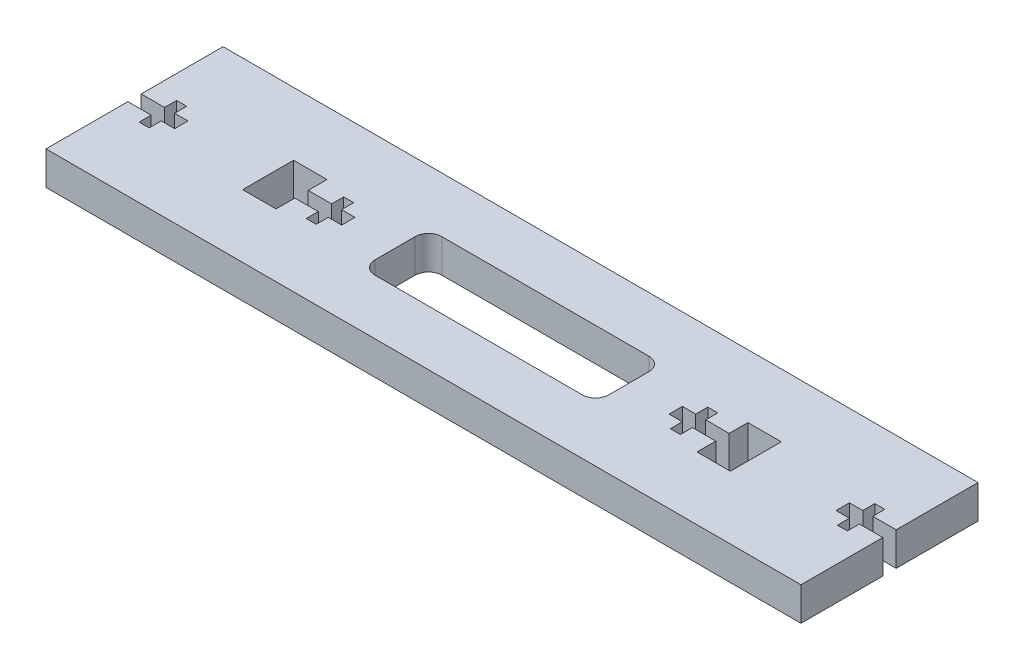
from build123d import *

# Parameters (mm, degrees)
ESBO_O1_W                = 113
ESBO_O1_H                = 26.5
RESSALTO_EXTRUS_O1_DEPTH = 5
ESBO_O2_W                = 5
ESBO_O2_H                = 7.62
CORTE_EXTRUS_O1_DEPTH    = 5
CORTE_EXTRUS_O2_DEPTH    = 5
CORTE_EXTRUS_O3_DEPTH    = 10


with BuildPart() as part:
    # Esboço1 → Ressalto-extrusão1 (new body)
    with BuildSketch(Plane(origin=(0, 0, 0), x_dir=(1, 0, 0), z_dir=(0, 1, 0))):
        with Locations((-20.23644711, -18.909257917)):
            Rectangle(ESBO_O1_W, ESBO_O1_H)
    extrude(amount=RESSALTO_EXTRUS_O1_DEPTH)

    # Esboço2 → Corte-extrusão1 (cut)
    with BuildSketch(Plane(origin=(0, 5, 0), x_dir=(1, 0, 0), z_dir=(0, 1, 0))):
        with Locations((13.76355289, -18.914257917)):
            Rectangle(ESBO_O2_W, ESBO_O2_H)
        with Locations((-54.23644711, -18.914257917)):
            Rectangle(ESBO_O2_W, ESBO_O2_H)
    extrude(amount=-CORTE_EXTRUS_O1_DEPTH, mode=Mode.SUBTRACT)

    # Esboço3 → Corte-extrusão2 (cut)
    with BuildSketch(Plane(origin=(0, 5, 0), x_dir=(1, 0, 0), z_dir=(0, 1, 0))):
        Polygon((-76.73644711, -17.909257917), (-73.23644711, -17.909257917), (-73.23644711, -16.109257917), (-71.73644711, -16.109257917), (-71.73644711, -17.909257917), (-69.73644711, -17.909257917), (-69.73644711, -19.909257917), (-71.73644711, -19.909257917), (-71.73644711, -21.709257917), (-73.23644711, -21.709257917), (-73.23644711, -19.909257917), (-76.73644711, -19.909257917), align=None)
        Polygon((-51.73644711, -17.909257917), (-48.23644711, -17.909257917), (-48.23644711, -16.109257917), (-46.73644711, -16.109257917), (-46.73644711, -17.909257917), (-44.73644711, -17.909257917), (-44.73644711, -19.909257917), (-46.73644711, -19.909257917), (-46.73644711, -21.709257917), (-48.23644711, -21.709257917), (-48.23644711, -19.909257917), (-51.73644711, -19.909257917), align=None)
    corte_extrus_o2 = extrude(amount=-CORTE_EXTRUS_O2_DEPTH, mode=Mode.SUBTRACT)

    # Espelhar1: Corte-extrusão2 across plane
    add(corte_extrus_o2.mirror(Plane.ZY.offset(20.23644711)), mode=Mode.SUBTRACT)

    # Esboço4 → Corte-extrusão3 (cut)
    with BuildSketch(Plane.XZ):
        with BuildLine():
            Line((-4.73644711, 13.909257917), (-35.73644711, 13.909257917))
            ThreePointArc((-35.73644711, 13.909257917), (-37.150660672, 14.495044355), (-37.73644711, 15.909257917))
            Line((-37.73644711, 15.909257917), (-37.73644711, 21.909257917))
            ThreePointArc((-37.73644711, 21.909257917), (-37.150660672, 23.32347148), (-35.73644711, 23.909257917))
            Line((-35.73644711, 23.909257917), (-4.73644711, 23.909257917))
            ThreePointArc((-4.73644711, 23.909257917), (-3.322233548, 23.32347148), (-2.73644711, 21.909257917))
            Line((-2.73644711, 21.909257917), (-2.73644711, 15.909257917))
            ThreePointArc((-2.73644711, 15.909257917), (-3.322233548, 14.495044355), (-4.73644711, 13.909257917))
        make_face()
    extrude(amount=-CORTE_EXTRUS_O3_DEPTH, mode=Mode.SUBTRACT)


solid = part.part
